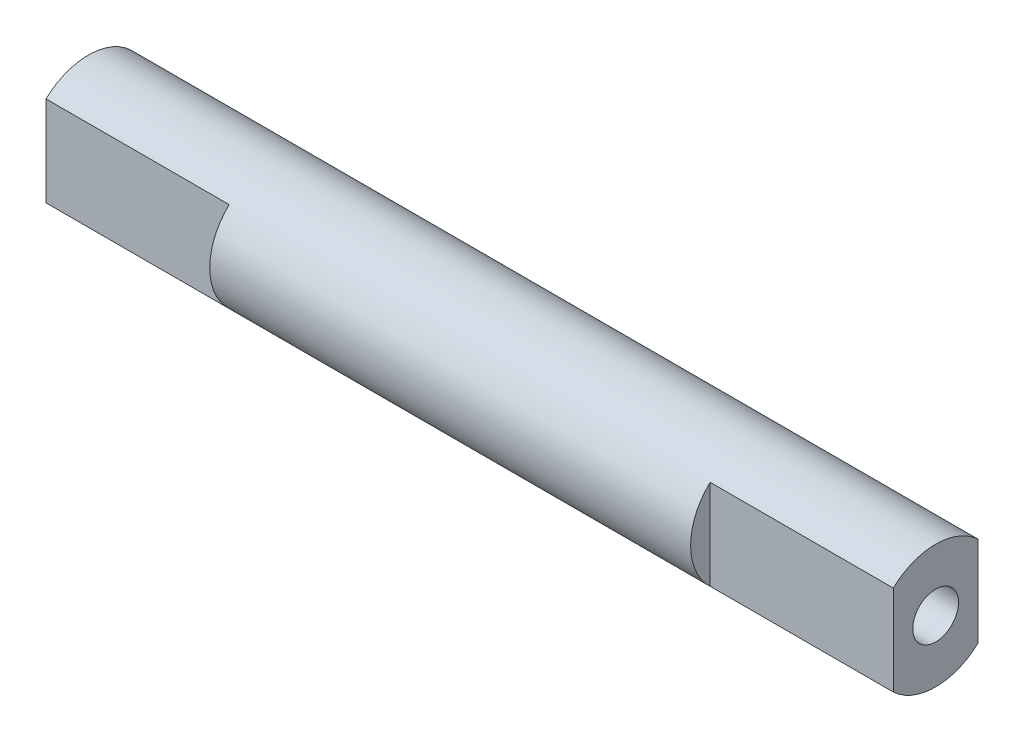
from build123d import *

# Parameters (mm, degrees)
SKETCH1_R           = 2.7
BOSS_EXTRUDE1_DEPTH = 18.5
CUT_EXTRUDE1_DEPTH  = 8
SKETCH3_R           = 1
CUT_EXTRUDE2_DEPTH  = 6


with BuildPart() as part:
    # Sketch1 → Boss-Extrude1 (new, symmetric)
    with BuildSketch(Plane(origin=(0, 0, 0), x_dir=(0, 0, -1), z_dir=(1, 0, 0))):
        Circle(SKETCH1_R)
    extrude(amount=BOSS_EXTRUDE1_DEPTH, both=True)

    # Sketch2 → Cut-Extrude1 (cut)
    with BuildSketch(Plane(origin=(18.5, 0, 0), x_dir=(0, 0, -1), z_dir=(1, 0, 0))):
        with BuildLine():
            Line((-1.85, 1.966596044), (-1.85, -1.966596044))
            ThreePointArc((-1.85, -1.966596044), (-2.7, 0), (-1.85, 1.966596044))
        make_face()
        with BuildLine():
            Line((1.85, 1.966596044), (1.85, -1.966596044))
            ThreePointArc((1.85, -1.966596044), (2.7, 0), (1.85, 1.966596044))
        make_face()
    cut_extrude1 = extrude(amount=-CUT_EXTRUDE1_DEPTH, mode=Mode.SUBTRACT)

    # Sketch3 → Cut-Extrude2 (cut)
    with BuildSketch(Plane(origin=(18.5, 0, 0), x_dir=(0, 0, -1), z_dir=(1, 0, 0))):
        Circle(SKETCH3_R)
    cut_extrude2 = extrude(amount=-CUT_EXTRUDE2_DEPTH, mode=Mode.SUBTRACT)

    # Mirror1: Cut-Extrude1, Cut-Extrude2 across plane
    add(cut_extrude1.mirror(Plane(origin=(0, 0, 0), x_dir=(0, 0, 1), z_dir=(1, 0, 0))), mode=Mode.SUBTRACT)
    add(cut_extrude2.mirror(Plane(origin=(0, 0, 0), x_dir=(0, 0, 1), z_dir=(1, 0, 0))), mode=Mode.SUBTRACT)


solid = part.part
